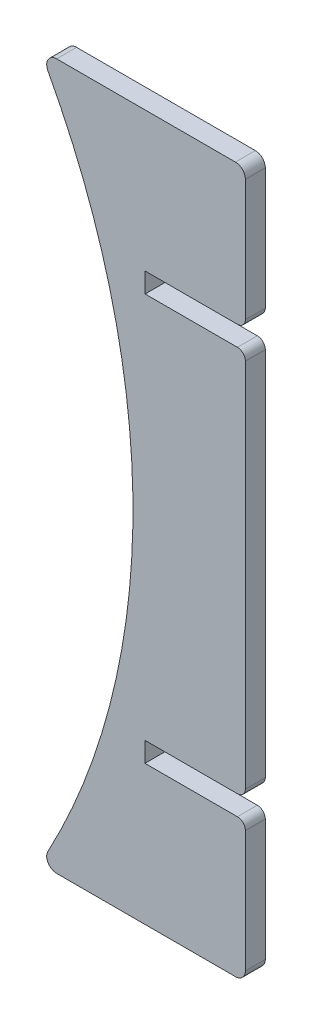
from build123d import *

# Parameters (mm, degrees)
RESSALTO_EXTRUS_O1_DEPTH = 5


with BuildPart() as part:
    # Model → Ressalto-extrusão1 (new body)
    with BuildSketch(Plane.XY):
        with BuildLine():
            Line((8.958908168, 92.500001378), (-14.205034542, 92.500001378))
            Line((-14.205034542, 92.500001378), (-14.205034542, 87.500001303))
            Line((-14.205034542, 87.500001303), (8.958908168, 87.500001303))
            ThreePointArc((8.958908168, 87.500001303), (10.37312173, 86.914214866), (10.958908168, 85.500001303))
            Line((10.958908168, 85.500001303), (10.958908168, -7.500000142))
            ThreePointArc((10.958908168, -7.500000142), (10.37312173, -8.914213705), (8.958908168, -9.500000142))
            Line((8.958908168, -9.500000142), (-14.237425511, -9.500000142))
            Line((-14.237425511, -9.500000142), (-14.237425511, -14.500000217))
            Line((-14.237425511, -14.500000217), (8.958908168, -14.500000217))
            ThreePointArc((8.958908168, -14.500000217), (10.37312173, -15.085786654), (10.958908168, -16.500000217))
            Line((10.958908168, -16.500000217), (10.958908168, -47.000089001))
            ThreePointArc((10.958908168, -47.000089001), (10.226675121, -48.767855954), (8.458908168, -49.500089001))
            Line((8.458908168, -49.500089001), (-36.392181846, -49.500089001))
            ThreePointArc((-36.392181846, -49.500089001), (-38.532153082, -48.292576181), (-38.604890155, -45.836507488))
            ThreePointArc((-38.604890155, -45.836507488), (-17.243723681, 39.000273479), (-38.605225502, 123.836970009))
            ThreePointArc((-38.605225502, 123.836970009), (-38.53196676, 126.292709214), (-36.392181846, 127.499913592))
            Line((-36.392181846, 127.499913592), (8.458908168, 127.499913592))
            ThreePointArc((8.458908168, 127.499913592), (10.226675121, 126.767680545), (10.958908168, 124.999913592))
            Line((10.958908168, 124.999913592), (10.958908168, 94.500001378))
            ThreePointArc((10.958908168, 94.500001378), (10.37312173, 93.085787815), (8.958908168, 92.500001378))
        make_face()
    extrude(amount=RESSALTO_EXTRUS_O1_DEPTH)


solid = part.part
